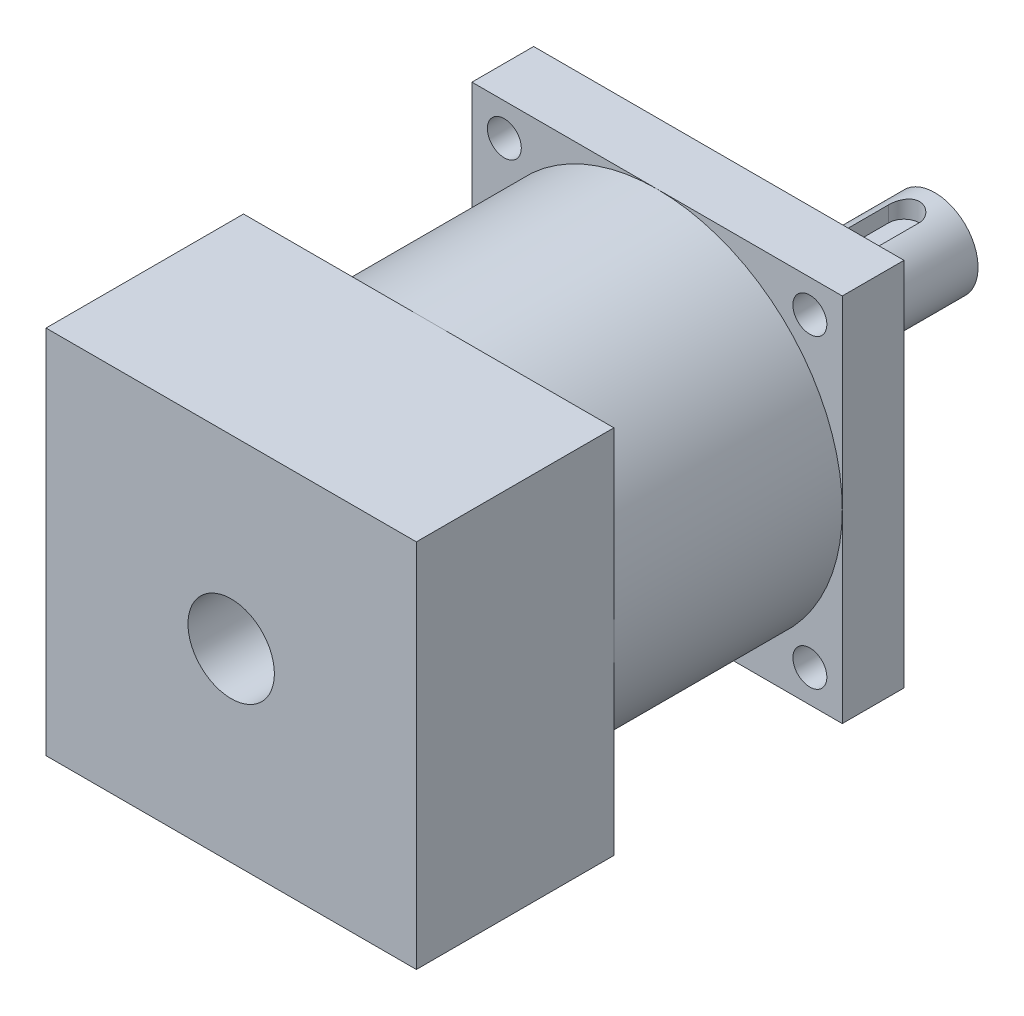
from build123d import *

# Parameters (mm, degrees)
SKETCH_1_W          = 60
SKETCH_1_H          = 60
EXTRUDE_1_DEPTH     = 10
SKETCH_3_R          = 30
EXTRUDE_2_DEPTH     = 37
SKETCH_4_W          = 60
SKETCH_4_H          = 60
EXTRUDE_3_DEPTH     = 32
SKETCH_5_R          = 25
EXTRUDE_4_DEPTH     = 3
SKETCH_6_R          = 8.5
EXTRUDE_5_DEPTH     = 2
SKETCH_7_R          = 7
EXTRUDE_6_DEPTH     = 30
SKETCH_8_R          = 7
CUT_EXTRUDE_1_DEPTH = 30
SKETCH_9_R          = 2.75
CUT_EXTRUDE_2_DEPTH = 30
CUT_EXTRUDE_3_DEPTH = 3


with BuildPart() as part:
    # 草图1 → 拉伸1 (new body)
    with BuildSketch(Plane.XY):
        with Locations((30, -30)):
            Rectangle(SKETCH_1_W, SKETCH_1_H)
    extrude(amount=EXTRUDE_1_DEPTH)

    # 草图3 → 拉伸2 (add)
    with BuildSketch(Plane.XY.offset(10)):
        with Locations((30, -30)):
            Circle(SKETCH_3_R)
    extrude(amount=EXTRUDE_2_DEPTH)

    # 草图4 → 拉伸3 (add)
    with BuildSketch(Plane.XY.offset(47)):
        with Locations((30, -30)):
            Rectangle(SKETCH_4_W, SKETCH_4_H)
    extrude(amount=EXTRUDE_3_DEPTH)

    # 草图5 → 拉伸4 (add)
    with BuildSketch(Plane(origin=(0, 0, 0), x_dir=(-1, 0, 0), z_dir=(0, 0, -1))):
        with Locations(Location((-30, -30, 0), (0, 0, 180))):
            Circle(SKETCH_5_R)
    extrude(amount=EXTRUDE_4_DEPTH)

    # 草图6 → 拉伸5 (add)
    with BuildSketch(Plane(origin=(0, 0, -3), x_dir=(-1, 0, 0), z_dir=(0, 0, -1))):
        with Locations((-30, -30)):
            Circle(SKETCH_6_R)
    extrude(amount=EXTRUDE_5_DEPTH)

    # 草图7 → 拉伸6 (add)
    with BuildSketch(Plane(origin=(0, 0, -5), x_dir=(-1, 0, 0), z_dir=(0, 0, -1))):
        with Locations((-30, -30)):
            Circle(SKETCH_7_R)
    extrude(amount=EXTRUDE_6_DEPTH)

    # 草图8 → 切除-拉伸1 (cut)
    with BuildSketch(Plane.XY.offset(79)):
        with Locations(Location((30, -30, 0), (0, 0, 180))):
            Circle(SKETCH_8_R)
    extrude(amount=-CUT_EXTRUDE_1_DEPTH, mode=Mode.SUBTRACT)

    # 草图9 → 切除-拉伸2 (cut)
    with BuildSketch(Plane(origin=(0, 0, 0), x_dir=(-1, 0, 0), z_dir=(0, 0, -1))):
        with Locations((-5.251262658, -5.251262658)):
            Circle(SKETCH_9_R)
        with Locations((-5.251262658, -54.748737342)):
            Circle(SKETCH_9_R)
        with Locations((-54.748737342, -54.748737342)):
            Circle(SKETCH_9_R)
        with Locations((-54.748737342, -5.251262658)):
            Circle(SKETCH_9_R)
    extrude(amount=-CUT_EXTRUDE_2_DEPTH, mode=Mode.SUBTRACT)

    # 草图10 → 切除-拉伸3 (cut)
    with BuildSketch(Plane(origin=(0, -23, 0), x_dir=(-1, 0, 0), z_dir=(0, 1, 0))):
        with BuildLine():
            Line((-32.5, -10), (-32.5, -30))
            ThreePointArc((-32.5, -30), (-30, -32.5), (-27.5, -30))
            Line((-27.5, -30), (-27.5, -10))
            ThreePointArc((-27.5, -10), (-30, -7.5), (-32.5, -10))
        make_face()
    extrude(amount=-CUT_EXTRUDE_3_DEPTH, mode=Mode.SUBTRACT)


solid = part.part
